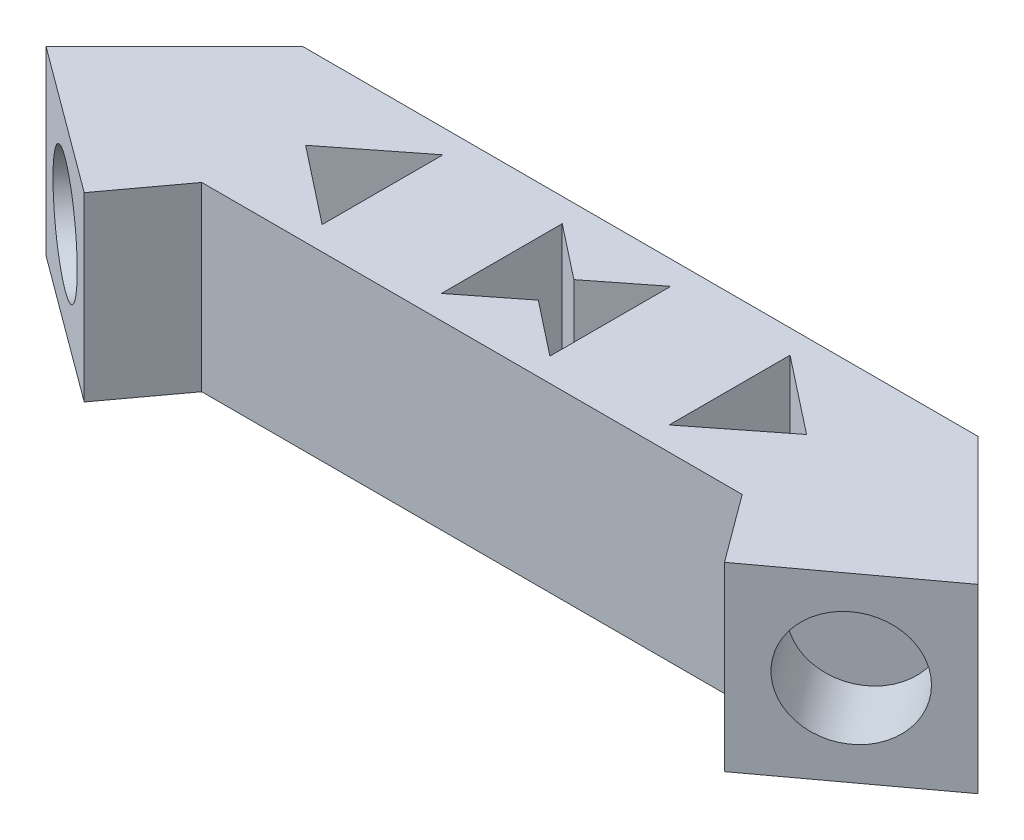
from build123d import *

# Parameters (mm, degrees)
BOSS_EXTRUDE1_DEPTH = 38.1
SKETCH2_R           = 12.065
CUT_EXTRUDE1_DEPTH  = 15.24
SKETCH3_R           = 12.065
CUT_EXTRUDE2_DEPTH  = 15.24
CUT_EXTRUDE3_DEPTH  = 38.1


with BuildPart() as part:
    # Sketch1 → Boss-Extrude1 (new body)
    with BuildSketch(Plane(origin=(0, 0, 0), x_dir=(1, 0, 0), z_dir=(0, 1, 0))):
        Polygon((0, 0), (113.579665808, 0), (124.068494586, -14.211767965), (154.723601267, 8.412874228), (127.782832904, 35.353642591), (-14.203167096, 35.353642591), (-41.143935459, 8.412874228), (-10.488828778, -14.211767965), align=None)
    extrude(amount=BOSS_EXTRUDE1_DEPTH)

    # Sketch2 → Cut-Extrude1 (cut)
    with BuildSketch(Plane(origin=(-10.488828778, 0, 14.211767965), x_dir=(0.8045959758833214, 0, 0.5938226297408727), z_dir=(-0.5938226297408727, 0, 0.8045959758833214))):
        with Locations((-19.05, 19.05)):
            Circle(SKETCH2_R)
    extrude(amount=-CUT_EXTRUDE1_DEPTH, mode=Mode.SUBTRACT)

    # Sketch3 → Cut-Extrude2 (cut)
    with BuildSketch(Plane(origin=(50.539894278, 0, 68.478689631), x_dir=(0.8045959758833213, 0, -0.5938226297408729), z_dir=(0.5938226297408729, 0, 0.8045959758833213))):
        with Locations((110.435742051, 19.05)):
            Circle(SKETCH3_R)
    extrude(amount=-CUT_EXTRUDE2_DEPTH, mode=Mode.SUBTRACT)

    # Sketch5 → Cut-Extrude3 (cut)
    with BuildSketch(Plane(origin=(0, 38.1, 0), x_dir=(1, 0, 0), z_dir=(0, 1, 0))):
        Polygon((4.151555437, 17.676821295), (20.32, 30.376821295), (20.32, 4.976821295), align=None)
        Polygon((45.384535252, 30.376821295), (45.384535252, 4.976821295), (56.789832904, 13.935461665), (68.195130556, 4.976821295), (68.195130556, 30.376821295), (56.789832904, 21.418180926), align=None)
        Polygon((93.259665808, 30.376821295), (93.259665808, 4.976821295), (109.428110371, 17.676821295), align=None)
    extrude(amount=-CUT_EXTRUDE3_DEPTH, mode=Mode.SUBTRACT)


solid = part.part
